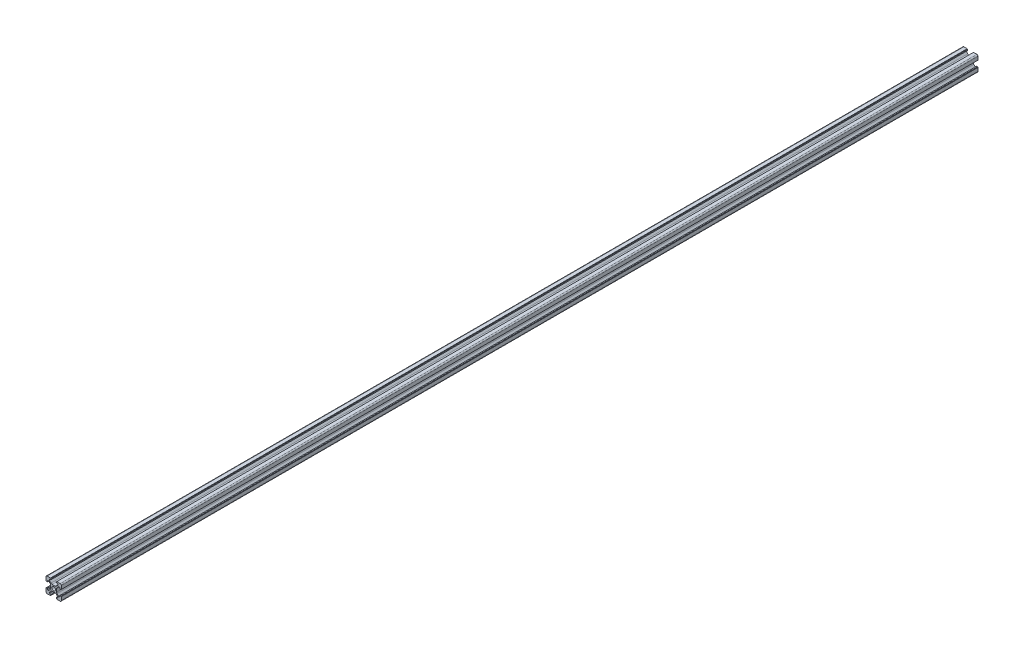
from build123d import *

# Parameters (mm, degrees)
SKETCH1_R           = 2.5
BOSS_EXTRUDE2_DEPTH = 1200


with BuildPart() as part:
    # Sketch1 → Boss-Extrude2 (new body)
    with BuildSketch(Plane.XY):
        with BuildLine():
            Line((10, -4.1), (10, -8.5))
            ThreePointArc((10, -8.5), (9.560660172, -9.560660172), (8.5, -10))
            Line((8.5, -10), (4.1, -10))
            Line((4.1, -10), (4.1, -9.5))
            Line((4.1, -9.5), (3.6, -9.5))
            Line((3.6, -9.5), (3.6, -8.2))
            Line((3.6, -8.2), (5.5, -8.2))
            Line((5.5, -8.2), (5.5, -6.560660172))
            Line((5.5, -6.560660172), (3.425126266, -4.485786438))
            ThreePointArc((3.425126266, -4.485786438), (2.776279568, -4.052240935), (2.010912703, -3.9))
            Line((2.010912703, -3.9), (-2.010912703, -3.9))
            ThreePointArc((-2.010912703, -3.9), (-2.776279568, -4.052240935), (-3.425126266, -4.485786438))
            Line((-3.425126266, -4.485786438), (-5.5, -6.560660172))
            Line((-5.5, -6.560660172), (-5.5, -8.2))
            Line((-5.5, -8.2), (-3.6, -8.2))
            Line((-3.6, -8.2), (-3.6, -9.5))
            Line((-3.6, -9.5), (-4.1, -9.5))
            Line((-4.1, -9.5), (-4.1, -10))
            Line((-4.1, -10), (-8.5, -10))
            ThreePointArc((-8.5, -10), (-9.560660172, -9.560660172), (-10, -8.5))
            Line((-10, -8.5), (-10, -4.1))
            Line((-10, -4.1), (-9.5, -4.1))
            Line((-9.5, -4.1), (-9.5, -3.6))
            Line((-9.5, -3.6), (-8.2, -3.6))
            Line((-8.2, -3.6), (-8.2, -5.5))
            Line((-8.2, -5.5), (-6.560660172, -5.5))
            Line((-6.560660172, -5.5), (-4.485786438, -3.425126266))
            ThreePointArc((-4.485786438, -3.425126266), (-4.052240935, -2.776279568), (-3.9, -2.010912703))
            Line((-3.9, -2.010912703), (-3.9, 2.010912703))
            ThreePointArc((-3.9, 2.010912703), (-4.052240935, 2.776279568), (-4.485786438, 3.425126266))
            Line((-4.485786438, 3.425126266), (-6.560660172, 5.5))
            Line((-6.560660172, 5.5), (-8.2, 5.5))
            Line((-8.2, 5.5), (-8.2, 3.6))
            Line((-8.2, 3.6), (-9.5, 3.6))
            Line((-9.5, 3.6), (-9.5, 4.1))
            Line((-9.5, 4.1), (-10, 4.1))
            Line((-10, 4.1), (-10, 8.5))
            ThreePointArc((-10, 8.5), (-9.560660172, 9.560660172), (-8.5, 10))
            Line((-8.5, 10), (-4.1, 10))
            Line((-4.1, 10), (-4.1, 9.5))
            Line((-4.1, 9.5), (-3.6, 9.5))
            Line((-3.6, 9.5), (-3.6, 8.2))
            Line((-3.6, 8.2), (-5.5, 8.2))
            Line((-5.5, 8.2), (-5.5, 6.560660172))
            Line((-5.5, 6.560660172), (-3.425126266, 4.485786438))
            ThreePointArc((-3.425126266, 4.485786438), (-2.776279568, 4.052240935), (-2.010912703, 3.9))
            Line((-2.010912703, 3.9), (2.010912703, 3.9))
            ThreePointArc((2.010912703, 3.9), (2.776279568, 4.052240935), (3.425126266, 4.485786438))
            Line((3.425126266, 4.485786438), (5.5, 6.560660172))
            Line((5.5, 6.560660172), (5.5, 8.2))
            Line((5.5, 8.2), (3.6, 8.2))
            Line((3.6, 8.2), (3.6, 9.5))
            Line((3.6, 9.5), (4.1, 9.5))
            Line((4.1, 9.5), (4.1, 10))
            Line((4.1, 10), (8.5, 10))
            ThreePointArc((8.5, 10), (9.560660172, 9.560660172), (10, 8.5))
            Line((10, 8.5), (10, 4.1))
            Line((10, 4.1), (9.5, 4.1))
            Line((9.5, 4.1), (9.5, 3.6))
            Line((9.5, 3.6), (8.2, 3.6))
            Line((8.2, 3.6), (8.2, 5.5))
            Line((8.2, 5.5), (6.560660172, 5.5))
            Line((6.560660172, 5.5), (4.485786438, 3.425126266))
            ThreePointArc((4.485786438, 3.425126266), (4.052240935, 2.776279568), (3.9, 2.010912703))
            Line((3.9, 2.010912703), (3.9, -2.010912703))
            ThreePointArc((3.9, -2.010912703), (4.052240935, -2.776279568), (4.485786438, -3.425126266))
            Line((4.485786438, -3.425126266), (6.560660172, -5.5))
            Line((6.560660172, -5.5), (8.2, -5.5))
            Line((8.2, -5.5), (8.2, -3.6))
            Line((8.2, -3.6), (9.5, -3.6))
            Line((9.5, -3.6), (9.5, -4.1))
            Line((9.5, -4.1), (10, -4.1))
        make_face()
        Circle(SKETCH1_R, mode=Mode.SUBTRACT)
    extrude(amount=BOSS_EXTRUDE2_DEPTH)


solid = part.part
